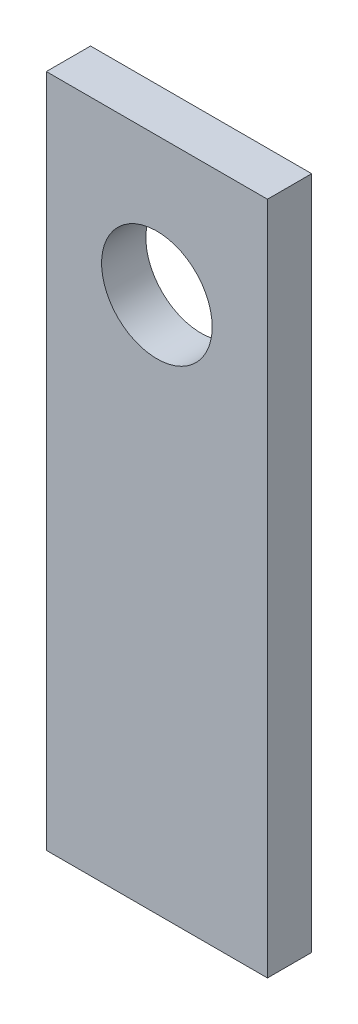
from build123d import *

# Parameters (mm, degrees)
SCHIZZO1_W                   = 20
SCHIZZO1_H                   = 61
ESTRUSIONE_ESTRUSIONE1_DEPTH = 4
SCHIZZO2_R                   = 5
TAGLIO_ESTRUSIONE1_DEPTH     = 4
FORO_PER_VITE_M2_2_D         = 2.4
FORO_PER_VITE_M2_2_DEPTH     = 4


with BuildPart() as part:
    # Schizzo1 → Estrusione-Estrusione1 (new body)
    with BuildSketch(Plane.XY):
        Rectangle(SCHIZZO1_W, SCHIZZO1_H)
    extrude(amount=ESTRUSIONE_ESTRUSIONE1_DEPTH)

    # Schizzo2 → Taglio-Estrusione1 (cut)
    with BuildSketch(Plane.XY.offset(4)):
        with Locations((0, 18)):
            Circle(SCHIZZO2_R)
    extrude(amount=-TAGLIO_ESTRUSIONE1_DEPTH, mode=Mode.SUBTRACT)

    # Foro per Vite M2-2
    with Locations(Plane(origin=(0, -30.5, 0), x_dir=(-1, 0, 0), z_dir=(0, -1, 0))):
        with Locations((5, -2), (-5, -2)):
            Hole(FORO_PER_VITE_M2_2_D / 2, depth=FORO_PER_VITE_M2_2_DEPTH)


solid = part.part
